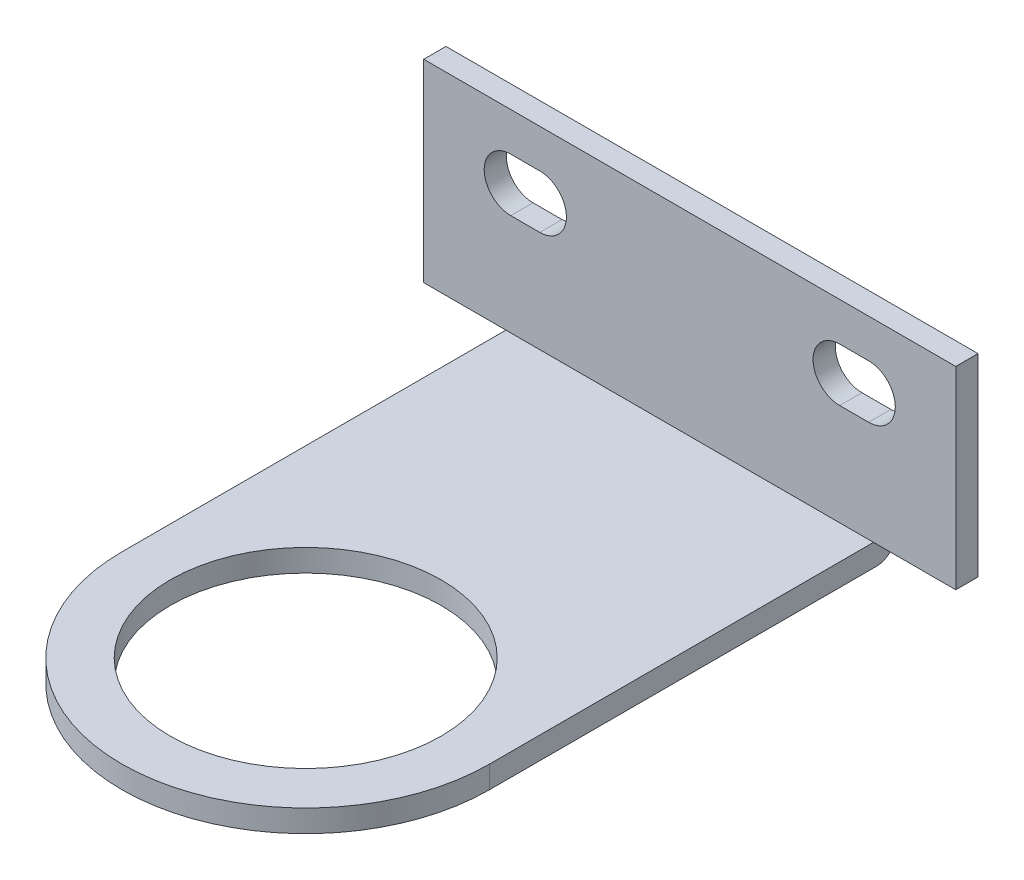
from build123d import *

# Parameters (mm, degrees)
SKETCH_1_R          = 14
EXTRUDE_1_DEPTH     = 2.3
EXTRUDE_2_DEPTH     = 20
FILLET_1_R          = 2
CUT_EXTRUDE_3_DEPTH = 71.530418969


with BuildPart() as part:
    # 草图1 → 拉伸1 (new body)
    with BuildSketch(Plane(origin=(0, 0, 0), x_dir=(1, 0, 0), z_dir=(0, 1, 0))):
        with BuildLine():
            Line((-19, 0), (-19, 42))
            Line((-19, 42), (19, 42))
            Line((19, 42), (19, 0))
            ThreePointArc((19, 0), (0, -19), (-19, 0))
        make_face()
        with Locations(Location((0, 0, 0), (0, 0, 270))):
            Circle(SKETCH_1_R, mode=Mode.SUBTRACT)
    extrude(amount=EXTRUDE_1_DEPTH)

    # 草图2 → 拉伸2 (add)
    with BuildSketch(Plane(origin=(0, 2.3, 0), x_dir=(1, 0, 0), z_dir=(0, 1, 0))):
        Polygon((0, 42), (27.5, 42), (27.5, 39.7), (-27.5, 39.7), (-27.5, 42), align=None)
    extrude(amount=EXTRUDE_2_DEPTH)

    # 圆角1
    fillet_1_edges = [part.edges().sort_by_distance(p)[0] for p in [
        (0, 0, -42),
    ]]
    fillet(fillet_1_edges, radius=FILLET_1_R)

    # 草图3 → 拉伸3 (cut, through all)
    with BuildSketch(Plane(origin=(0, 0, -42), x_dir=(-1, 0, 0), z_dir=(0, 0, -1))):
        with BuildLine():
            Line((-18.5, 18.3), (-15.5, 18.3))
            ThreePointArc((-15.5, 18.3), (-12.75, 15.55), (-15.5, 12.8))
            Line((-15.5, 12.8), (-18.5, 12.8))
            ThreePointArc((-18.5, 12.8), (-21.25, 15.55), (-18.5, 18.3))
        make_face()
        with BuildLine():
            Line((15.5, 18.3), (18.5, 18.3))
            ThreePointArc((18.5, 18.3), (21.25, 15.55), (18.5, 12.8))
            Line((18.5, 12.8), (15.5, 12.8))
            ThreePointArc((15.5, 12.8), (12.75, 15.55), (15.5, 18.3))
        make_face()
    extrude(amount=-CUT_EXTRUDE_3_DEPTH, mode=Mode.SUBTRACT)


solid = part.part
